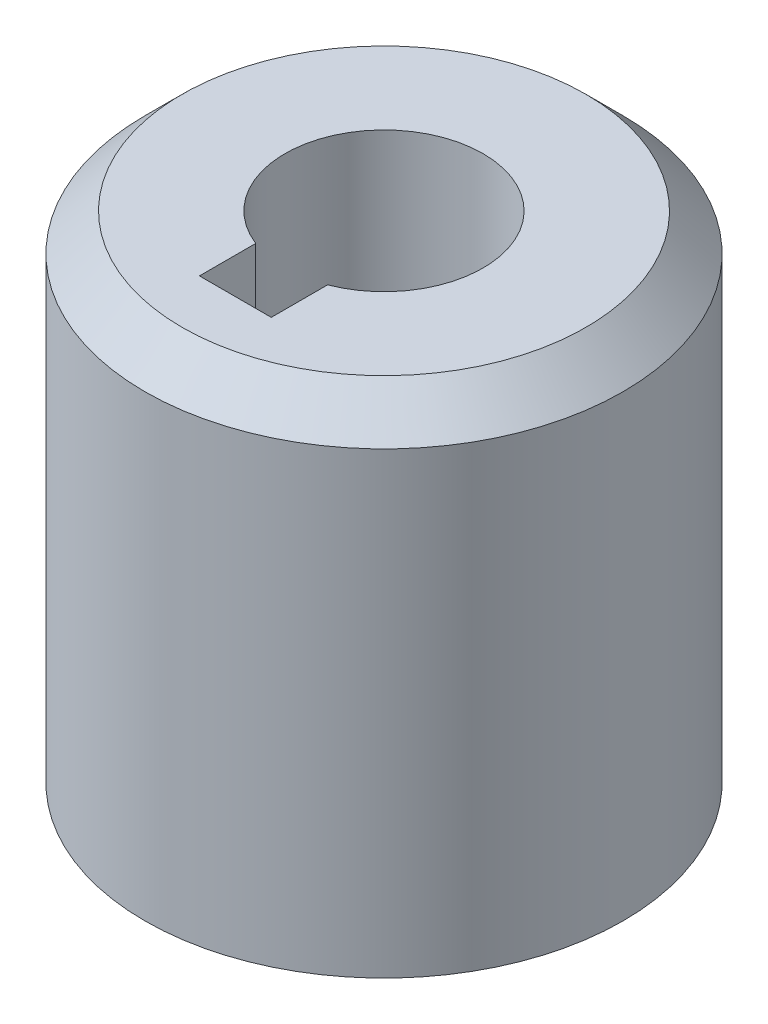
from build123d import *

# Parameters (mm, degrees)
SKETCH1_R           = 9.65
BOSS_EXTRUDE1_DEPTH = 20
CHAMFER1_SIZE       = 1.5


with BuildPart() as part:
    # Sketch1 → Boss-Extrude1 (new body)
    with BuildSketch(Plane(origin=(0, 0, 0), x_dir=(1, 0, 0), z_dir=(0, 1, 0))):
        with Locations(Location((0, 0, 0), (0, 0, 270))):
            Circle(SKETCH1_R)
        with BuildLine():
            Line((-1.45, -6), (1.45, -6))
            Line((1.45, -6), (1.45, -3.727935085))
            ThreePointArc((1.45, -3.727935085), (0, 4), (-1.45, -3.727935085))
            Line((-1.45, -3.727935085), (-1.45, -6))
        make_face(mode=Mode.SUBTRACT)
    extrude(amount=BOSS_EXTRUDE1_DEPTH)

    # Chamfer1
    chamfer1_edges = [part.edges().sort_by_distance(p)[0] for p in [
        (0, 20, -9.65),
    ]]
    chamfer(chamfer1_edges, length=CHAMFER1_SIZE)


solid = part.part
